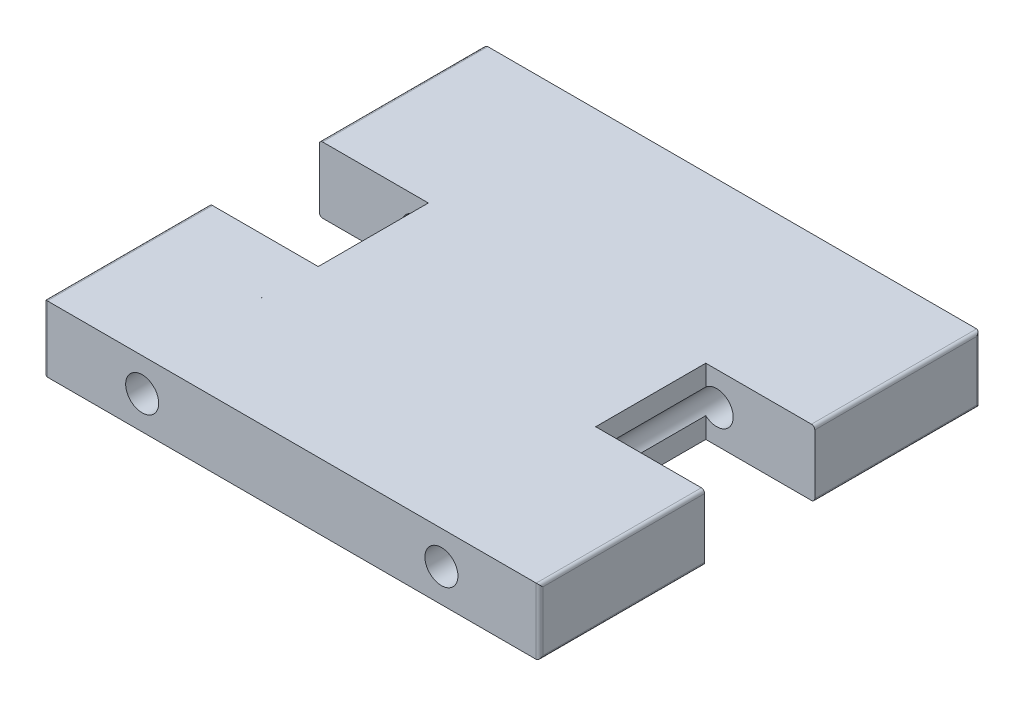
from build123d import *

# Parameters (mm, degrees)
ESTRUSIONE_ESTRUSIONE1_DEPTH  = 60
TAGLIO_ESTRUSIONE2_DEPTH      = 606.061980296
TAGLIO_ESTRUSIONE2_DEPTH_BACK = 606.061980296
SCHIZZO3_OUTSIDE_W            = 573.012
SCHIZZO3_OUTSIDE_H            = 183.012
SCHIZZO3_OUTSIDE_R            = 15
SCHIZZO4_W                    = 100
SCHIZZO4_H                    = 100
TAGLIO_ESTRUSIONE3_DEPTH      = 606.061980296


with BuildPart() as part:
    # Schizzo1 → Estrusione-Estrusione1 (new body)
    with BuildSketch(Plane(origin=(0, 0, 0), x_dir=(1, 0, 0), z_dir=(0, 1, 0))):
        with BuildLine():
            Line((3, 0), (447, 0))
            ThreePointArc((447, 0), (449.121320344, 0.878679656), (450, 3))
            Line((450, 3), (450, 397))
            ThreePointArc((450, 397), (449.121320344, 399.121320344), (447, 400))
            Line((447, 400), (3, 400))
            ThreePointArc((3, 400), (0.878679656, 399.121320344), (0, 397))
            Line((0, 397), (0, 3))
            ThreePointArc((0, 3), (0.878679656, 0.878679656), (3, 0))
        make_face()
    extrude(amount=ESTRUSIONE_ESTRUSIONE1_DEPTH)

    # Schizzo3 outside → Taglio-Estrusione2 (cut, two sides: drawn at the far end of the back side and taken through both)
    # profile 1 of 3: a face of its own
    with BuildSketch(Plane.XY.offset(-TAGLIO_ESTRUSIONE2_DEPTH_BACK)):
        with Locations((225, 30)):
            Rectangle(SCHIZZO3_OUTSIDE_W, SCHIZZO3_OUTSIDE_H)
        with BuildLine():
            Line((3, 60), (447, 60))
            ThreePointArc((447, 60), (449.121320344, 59.121320344), (450, 57))
            Line((450, 57), (450, 3))
            ThreePointArc((450, 3), (449.121320344, 0.878679656), (447, 0))
            Line((447, 0), (3, 0))
            ThreePointArc((3, 0), (0.878679656, 0.878679656), (0, 3))
            Line((0, 3), (0, 57))
            ThreePointArc((0, 57), (0.878679656, 59.121320344), (3, 60))
        make_face(mode=Mode.SUBTRACT)
    # profile 2 of 3: a face of its own
    with BuildSketch(Plane.XY.offset(-TAGLIO_ESTRUSIONE2_DEPTH_BACK)):
        with Locations((89.1, 30)):
            Circle(SCHIZZO3_OUTSIDE_R)
    # profile 3 of 3: a face of its own
    with BuildSketch(Plane.XY.offset(-TAGLIO_ESTRUSIONE2_DEPTH_BACK)):
        with Locations((360.9, 30)):
            Circle(SCHIZZO3_OUTSIDE_R)
    extrude(amount=TAGLIO_ESTRUSIONE2_DEPTH + TAGLIO_ESTRUSIONE2_DEPTH_BACK, mode=Mode.SUBTRACT)

    # Schizzo4 → Taglio-Estrusione3 (cut, through all)
    with BuildSketch(Plane(origin=(0, 0, 0), x_dir=(1, 0, 0), z_dir=(0, 1, 0))):
        with Locations((49, 200)):
            Rectangle(SCHIZZO4_W, SCHIZZO4_H)
        with Locations((401, 200)):
            Rectangle(SCHIZZO4_W, SCHIZZO4_H)
    extrude(amount=TAGLIO_ESTRUSIONE3_DEPTH, mode=Mode.SUBTRACT)


solid = part.part
